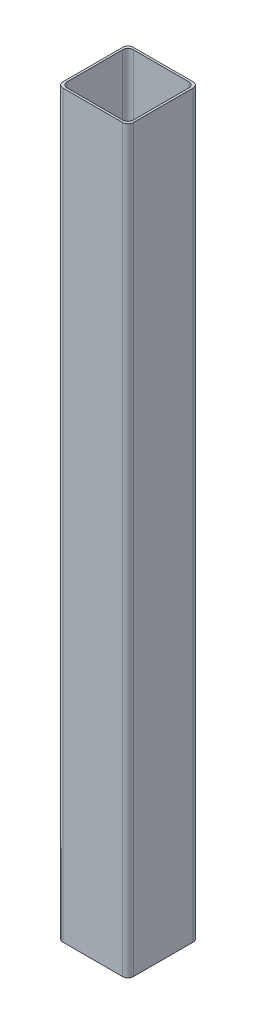
from build123d import *

# Parameters (mm, degrees)
ESBO_O1_W                = 40
ESBO_O1_H                = 40
ESBO_O1_W_2              = 37.6
ESBO_O1_H_2              = 37.6
RESSALTO_EXTRUS_O1_DEPTH = 210
FILETE1_R                = 3


with BuildPart() as part:
    # Esboço1 → Ressalto-extrusão1 (new, symmetric)
    with BuildSketch(Plane(origin=(0, 0, 0), x_dir=(1, 0, 0), z_dir=(0, 1, 0))):
        Rectangle(ESBO_O1_W, ESBO_O1_H)
        Rectangle(ESBO_O1_W_2, ESBO_O1_H_2, mode=Mode.SUBTRACT)
    extrude(amount=RESSALTO_EXTRUS_O1_DEPTH, both=True)

    # Filete1
    filete1_edges = [part.edges().sort_by_distance(p)[0] for p in [
        (-18.8, 0, 18.8),
        (18.8, 0, 18.8),
        (18.8, 0, -18.8),
        (-18.8, 0, -18.8),
        (-20, 0, -20),
        (20, 0, -20),
        (20, 0, 20),
        (-20, 0, 20),
    ]]
    fillet(filete1_edges, radius=FILETE1_R)


solid = part.part
